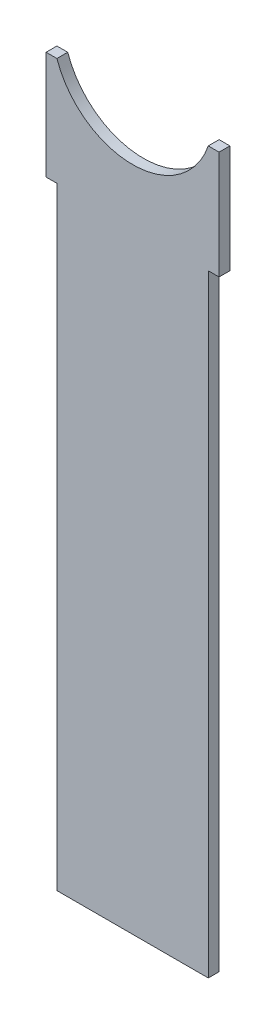
from build123d import *

# Parameters (mm, degrees)
SKETCH2_W           = 1.5875
SKETCH2_H           = 7.9375
BOSS_EXTRUDE1_DEPTH = 1.5875


with BuildPart() as part:
    # Sketch2 → Boss-Extrude1 (new body)
    with BuildSketch(Plane.XY):
        Polygon((-6.5e-08, -7.9375), (-11.1125, -7.9375), (-11.1125, -15.875), (-11.1125, -105.804584263), (11.1125, -105.804584263), (11.1125, -15.875), (11.1125, -7.9375), align=None)
        with BuildLine():
            ThreePointArc((11.1125, 0), (6.828095654, -5.749333972), (-6.5e-08, -7.9375))
            Line((-6.5e-08, -7.9375), (11.1125, -7.9375))
            Line((11.1125, -7.9375), (11.1125, 0))
        make_face()
        with Locations((11.90625, -3.96875)):
            Rectangle(SKETCH2_W, SKETCH2_H)
        with Locations((11.90625, -11.90625)):
            Rectangle(SKETCH2_W, SKETCH2_H)
        with Locations((-11.90625, -11.90625)):
            Rectangle(SKETCH2_W, SKETCH2_H)
        with Locations((-11.90625, -3.96875)):
            Rectangle(SKETCH2_W, SKETCH2_H)
        with BuildLine():
            Line((-11.1125, 0), (-11.1125, -7.9375))
            Line((-11.1125, -7.9375), (-6.5e-08, -7.9375))
            ThreePointArc((-6.5e-08, -7.9375), (-6.828095707, -5.749333934), (-11.1125, 0))
        make_face()
    extrude(amount=BOSS_EXTRUDE1_DEPTH)


solid = part.part
